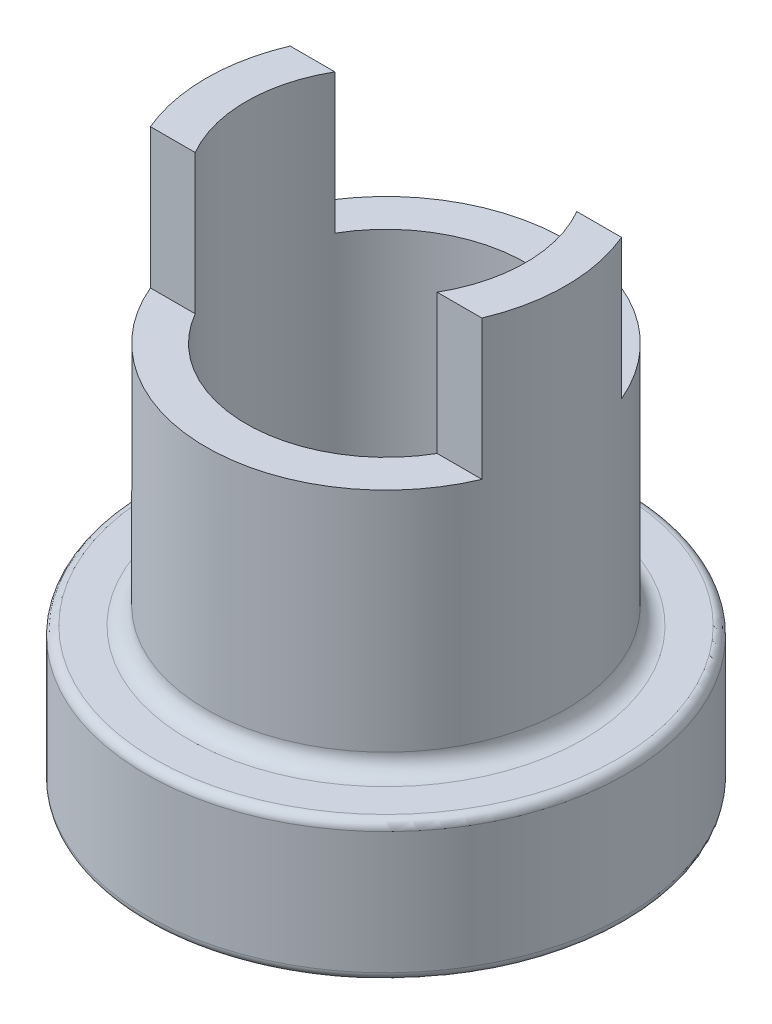
from build123d import *

# Parameters (mm, degrees)
SKETCH2_R          = 4
CUT_EXTRUDE1_DEPTH = 18.875437058
SKETCH3_W          = 3.15
SKETCH3_H          = 4
CUT_EXTRUDE2_DEPTH = 21.417302711
FILLET1_R          = 0.5
FILLET2_R          = 0.25
CHAMFER1_SIZE      = 0.75


with BuildPart() as part:
    # Sketch1 → Revolve1 (revolve)
    with BuildSketch(Plane.XY):
        Polygon((0, 0), (-6.875, 0), (-6.875, 4), (-5.15, 4), (-5.15, 15), (0, 15), align=None)
    revolve(axis=Axis((0, 15, 0), (0, -1, 0)))

    # Sketch2 → Cut-Extrude1 (cut, through all)
    with BuildSketch(Plane(origin=(0, 15, 0), x_dir=(1, 0, 0), z_dir=(0, 1, 0))):
        with Locations(Location((0, 0, 0), (0, 0, 180))):
            Circle(SKETCH2_R)
    extrude(amount=-CUT_EXTRUDE1_DEPTH, mode=Mode.SUBTRACT)

    # Sketch3 → Cut-Extrude2 (cut, through all)
    with BuildSketch(Plane(origin=(5.15, 0, 0), x_dir=(0, 0, -1), z_dir=(1, 0, 0))):
        with Locations((-3.575, 13)):
            Rectangle(SKETCH3_W, SKETCH3_H)
        with Locations((3.575, 13)):
            Rectangle(SKETCH3_W, SKETCH3_H)
    extrude(amount=-CUT_EXTRUDE2_DEPTH, mode=Mode.SUBTRACT)

    # Fillet1
    fillet1_edges = [part.edges().sort_by_distance(p)[0] for p in [
        (5.15, 4, 0),
    ]]
    fillet(fillet1_edges, radius=FILLET1_R)

    # Fillet2
    fillet2_edges = [part.edges().sort_by_distance(p)[0] for p in [
        (6.875, 4, 0),
        (6.875, 0, 0),
    ]]
    fillet(fillet2_edges, radius=FILLET2_R)

    # Chamfer1
    chamfer1_edges = [part.edges().sort_by_distance(p)[0] for p in [
        (4, 0, 0),
    ]]
    chamfer(chamfer1_edges, length=CHAMFER1_SIZE)


solid = part.part
